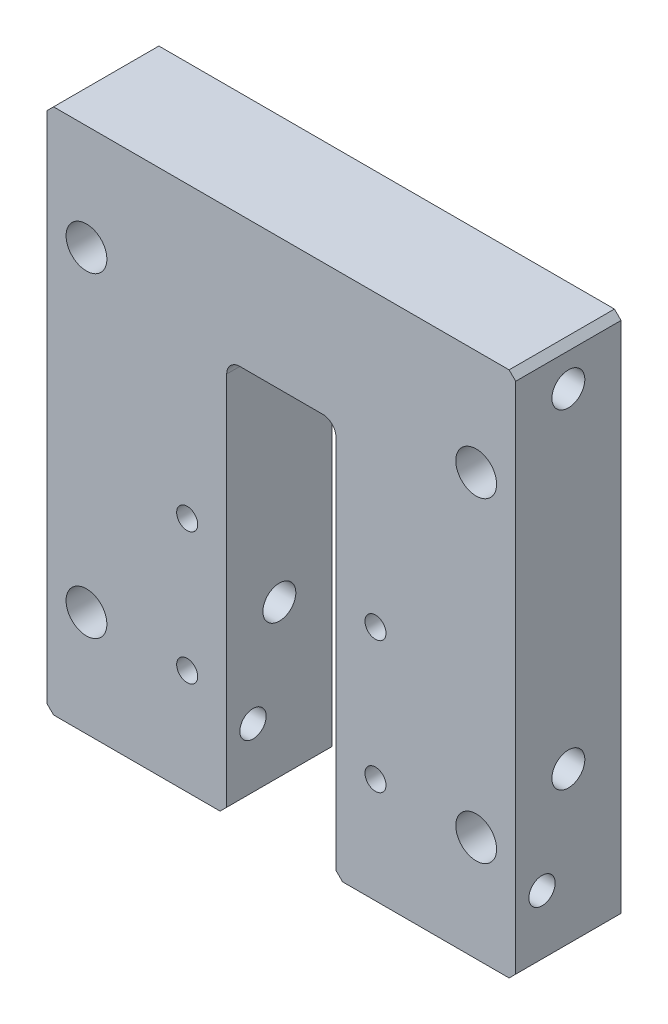
from build123d import *

# Parameters (mm, degrees)
SKETCH_1_W          = 35.6
SKETCH_1_H          = 40
EXTRUDE_1_DEPTH     = 8
SKETCH_5_R          = 1
CUT_EXTRUDE_1_DEPTH = 42
SKETCH_6_W          = 8.3
SKETCH_6_H          = 60
CUT_EXTRUDE_2_DEPTH = 10
SKETCH_2_R          = 1.55
CUT_EXTRUDE_3_DEPTH = 10
HOLE_WIZARD_M2_1_D  = 1.6
HOLE_WIZARD_M3_2_D  = 2.5
FILLET_1_R          = 1
CHAMFER_1_SIZE      = 0.5


with BuildPart() as part:
    # 草图1 → 凸台-拉伸1 (new body)
    with BuildSketch(Plane.XY):
        Rectangle(SKETCH_1_W, SKETCH_1_H)
    extrude(amount=EXTRUDE_1_DEPTH)

    # 草图5 → 切除-拉伸1 (cut)
    with BuildSketch(Plane.ZY.offset(17.8)):
        with Locations((6, -15)):
            Circle(SKETCH_5_R)
    extrude(amount=-CUT_EXTRUDE_1_DEPTH, mode=Mode.SUBTRACT)

    # 草图6 → 切除-拉伸2 (cut)
    with BuildSketch(Plane.XY.offset(8)):
        with Locations((0, -20)):
            Rectangle(SKETCH_6_W, SKETCH_6_H)
    extrude(amount=-CUT_EXTRUDE_2_DEPTH, mode=Mode.SUBTRACT)

    # 草图2 → 切除-拉伸3 (cut)
    with BuildSketch(Plane.XY.offset(8)):
        with Locations((14.8, 12)):
            Circle(SKETCH_2_R)
        with Locations((-14.8, 12)):
            Circle(SKETCH_2_R)
        with Locations((-14.8, -12)):
            Circle(SKETCH_2_R)
        with Locations((14.8, -12)):
            Circle(SKETCH_2_R)
    extrude(amount=-CUT_EXTRUDE_3_DEPTH, mode=Mode.SUBTRACT)

    # M2 螺纹孔1 (through all)
    with Locations(Plane.XY.offset(8)):
        with Locations((-7.15, -12), (-7.15, -2)):
            hole_wizard_m2_1 = Hole(HOLE_WIZARD_M2_1_D / 2)

    # 镜向1: M2 螺纹孔1 across plane
    add(hole_wizard_m2_1.mirror(Plane(origin=(0, 0, 0), x_dir=(0, 0, 1), z_dir=(1, 0, 0))), mode=Mode.SUBTRACT)

    # M3 螺纹孔2 (through all)
    with Locations(Plane.ZY.offset(17.8)):
        with Locations((4, 17), (4, -8)):
            Hole(HOLE_WIZARD_M3_2_D / 2)

    # 圆角1
    fillet_1_edges = [part.edges().sort_by_distance(p)[0] for p in [
        (4.15, 10, 4),
        (-4.15, 10, 4),
    ]]
    fillet(fillet_1_edges, radius=FILLET_1_R)

    # 倒角1
    chamfer_1_edges = [part.edges().sort_by_distance(p)[0] for p in [
        (4.15, -20, 4),
        (-4.15, -20, 4),
        (17.8, -20, 4),
        (-17.8, -20, 4),
        (-17.8, 20, 4),
        (17.8, 20, 4),
    ]]
    chamfer(chamfer_1_edges, length=CHAMFER_1_SIZE)


solid = part.part
